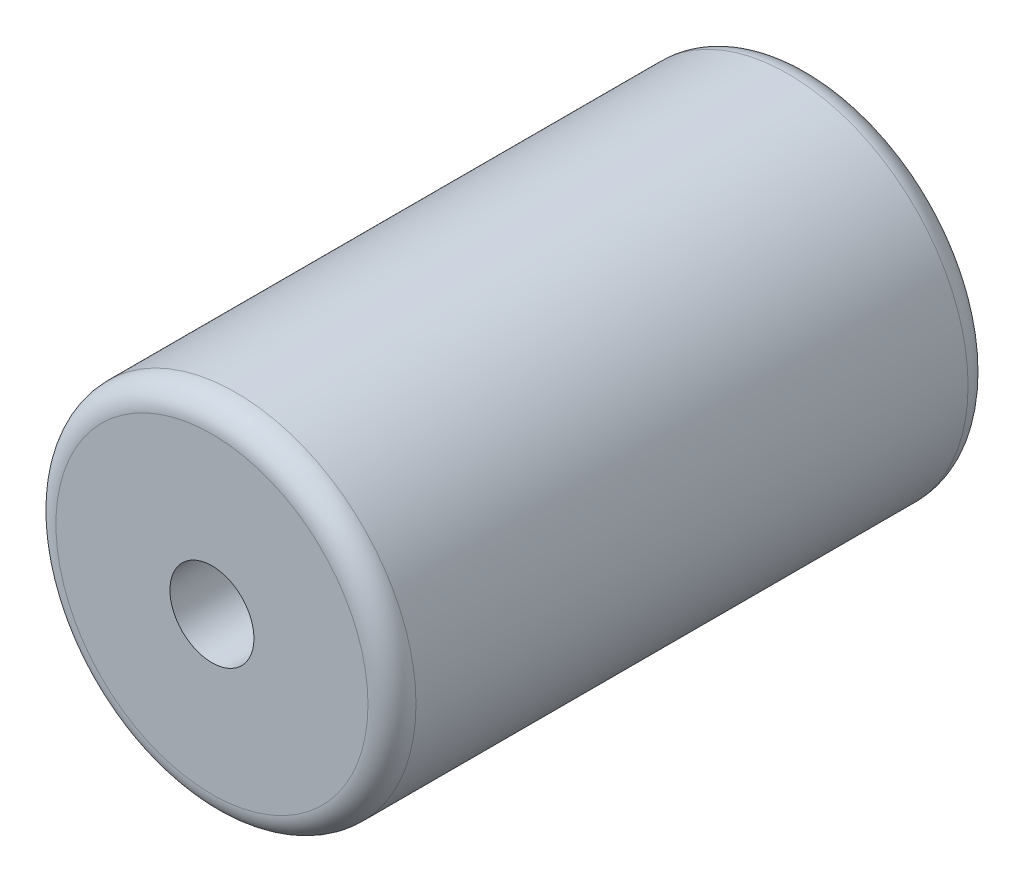
from build123d import *

# Parameters (mm, degrees)
SKETCH1_R           = 1.5
SKETCH1_R_2         = 0.35
BOSS_EXTRUDE1_DEPTH = 2.5
FILLET1_R           = 0.2
FILLET2_R           = 0.2


with BuildPart() as part:
    # Sketch1 → Boss-Extrude1 (new, symmetric)
    with BuildSketch(Plane.XY):
        Circle(SKETCH1_R)
        Circle(SKETCH1_R_2, mode=Mode.SUBTRACT)
    extrude(amount=BOSS_EXTRUDE1_DEPTH, both=True)

    # Fillet1
    fillet1_edges = [part.edges().sort_by_distance(p)[0] for p in [
        (-1.5, 0, 2.5),
    ]]
    fillet(fillet1_edges, radius=FILLET1_R)

    # Fillet2
    fillet2_edges = [part.edges().sort_by_distance(p)[0] for p in [
        (-1.5, 0, -2.5),
    ]]
    fillet(fillet2_edges, radius=FILLET2_R)


solid = part.part
